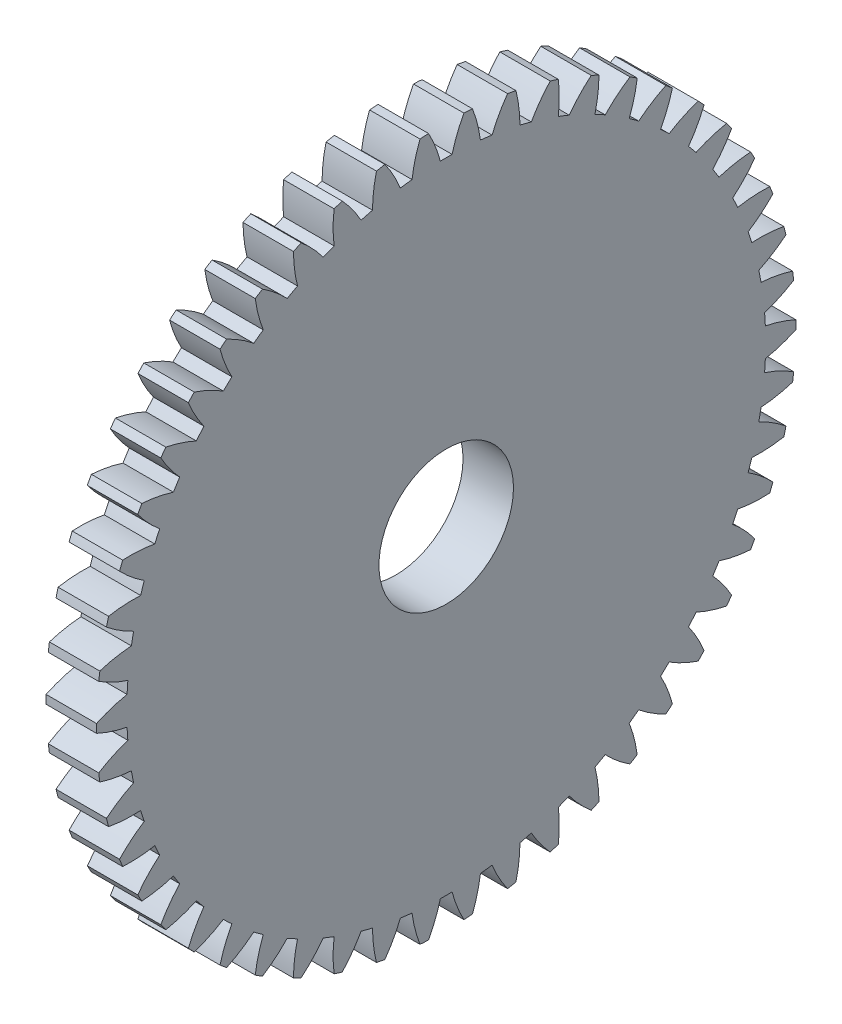
from build123d import *

# Parameters (mm, degrees)
BASPROSKE_W        = 3
BASPROSKE_H        = 20.8
TOOTHCUT_DEPTH     = 30.56822619
TEETHCUTS_COUNT    = 50
TEETHCUTS_ANGLE    = 352.8
BORSKE_R           = 1
BORE_DEPTH         = 50.0000508
SKETCH1_R          = 4
CUT_EXTRUDE2_DEPTH = 3


with BuildPart() as part:
    # BasProSke → Base-Revolve (revolve)
    with BuildSketch(Plane(origin=(0, 0, 0), x_dir=(1, 0, 0), z_dir=(0, 1, 0)), mode=Mode.PRIVATE) as base_revolve_sk:
        with Locations((1.5, 10.4)):
            Rectangle(BASPROSKE_W, BASPROSKE_H)
    revolve(base_revolve_sk.sketch.rotate(Axis((-10, 0, 0), (1, 0, 0)), 180), axis=Axis((-10, 0, 0), (1, 0, 0)))

    # TooCutSke → ToothCut (cut, through all)
    with BuildSketch(Plane(origin=(0, 0, 0), x_dir=(0, 0, -1), z_dir=(1, 0, 0))):
        with BuildLine():
            ThreePointArc((0.349413338, 18.995786673), (0, 18.999), (-0.349413338, 18.995786673))
            ThreePointArc((-0.349413338, 18.995786673), (-0.652647392, 19.918735641), (-1.065517852, 20.798123879))
            ThreePointArc((-1.065517852, 20.798123879), (0, 20.8254), (1.065517852, 20.798123879))
            ThreePointArc((1.065517852, 20.798123879), (0.652647392, 19.918735641), (0.349413338, 18.995786673))
        make_face()
    toothcut = extrude(amount=TOOTHCUT_DEPTH, mode=Mode.SUBTRACT)

    # TeethCuts: ToothCut ×50 about axis
    teethcuts_axis = Axis((-10, 0, 0), (1, 0, 0))
    for i in range(1, TEETHCUTS_COUNT):
        add(toothcut.rotate(teethcuts_axis, i * TEETHCUTS_ANGLE / (TEETHCUTS_COUNT - 1)), mode=Mode.SUBTRACT)

    # BorSke → Bore (cut, symmetric)
    with BuildSketch(Plane(origin=(0, 0, 0), x_dir=(0, 0, -1), z_dir=(1, 0, 0))):
        with Locations(Location((0, 0, 0), (0, 0, 180))):
            Circle(BORSKE_R)
    extrude(amount=BORE_DEPTH, both=True, mode=Mode.SUBTRACT)

    # Sketch1 → Cut-Extrude2 (cut)
    with BuildSketch(Plane(origin=(3, 0, 0), x_dir=(0, 0, -1), z_dir=(1, 0, 0))):
        Circle(SKETCH1_R)
    extrude(amount=-CUT_EXTRUDE2_DEPTH, mode=Mode.SUBTRACT)


solid = part.part
